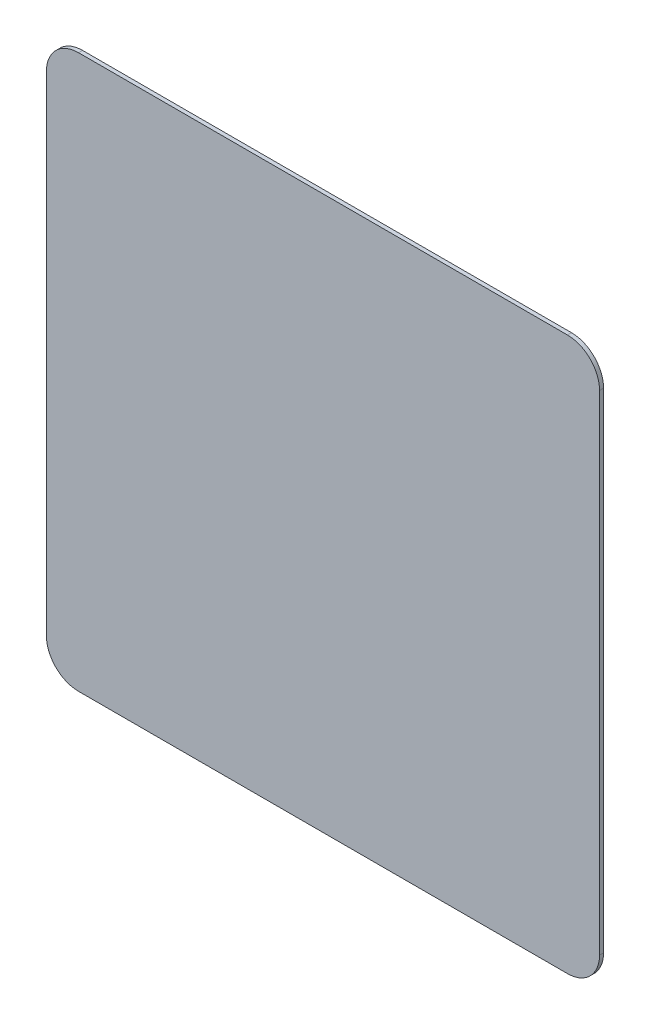
from build123d import *

# Parameters (mm, degrees)
SKETCH1_W           = 219.075
SKETCH1_H           = 219.075
BOSS_EXTRUDE1_DEPTH = 1.5875
FILLET13_R          = 12.7
FILLET14_R          = 12.7


with BuildPart() as part:
    # Sketch1 → Boss-Extrude1 (new body)
    with BuildSketch(Plane.XY):
        with Locations((109.5375, -109.5375)):
            Rectangle(SKETCH1_W, SKETCH1_H)
    extrude(amount=BOSS_EXTRUDE1_DEPTH)

    # Fillet13
    fillet13_edges = [part.edges().sort_by_distance(p)[0] for p in [
        (219.075, 0, 0.79375),
        (219.075, -219.075, 0.79375),
    ]]
    fillet(fillet13_edges, radius=FILLET13_R)

    # Fillet14
    fillet14_edges = [part.edges().sort_by_distance(p)[0] for p in [
        (0, 0, 0.79375),
        (0, -219.075, 0.79375),
    ]]
    fillet(fillet14_edges, radius=FILLET14_R)


solid = part.part
